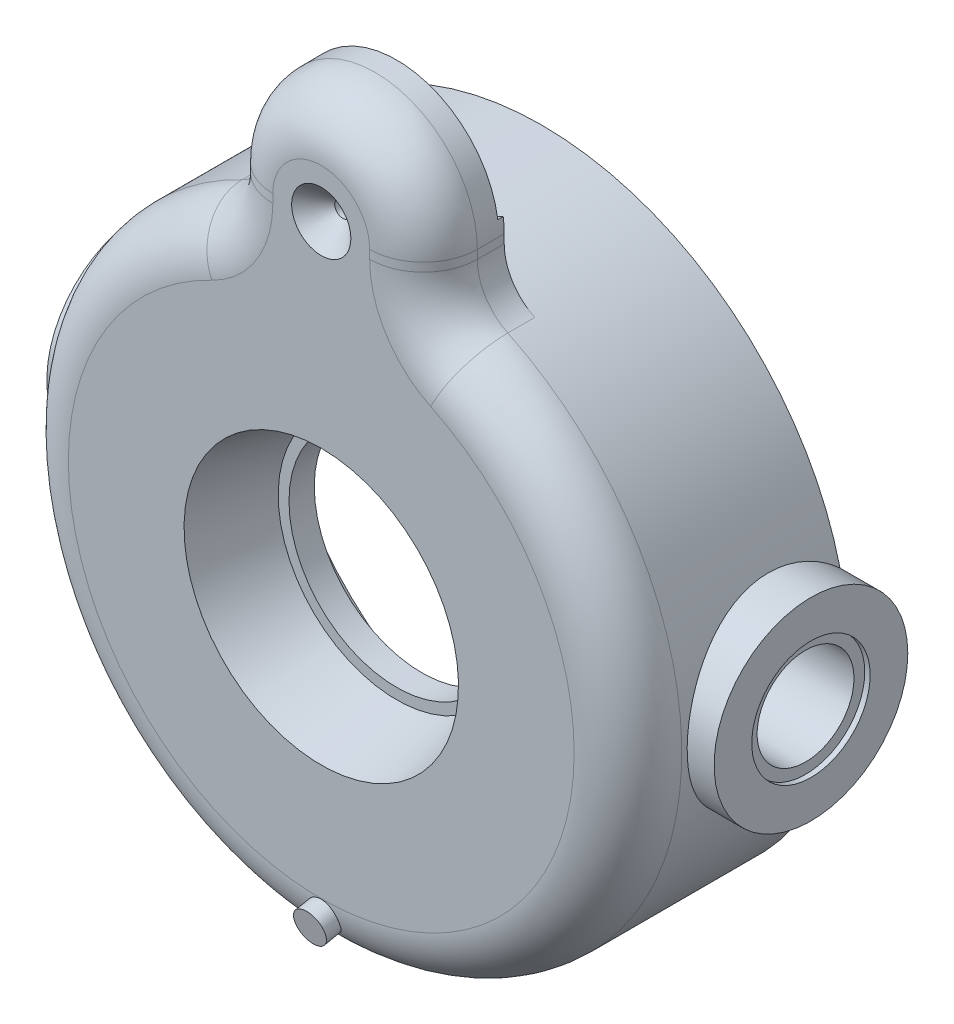
from build123d import *

# Parameters (mm, degrees)
SKETCH_1_R            = 57
EXTRUDE_1_DEPTH       = 41
EXTRUDE_START         = -15
EXTRUDE_3_DEPTH       = 15
SKETCH_5_R            = 40
CUT_EXTRUDE_1_DEPTH   = 1
SKETCH_6_R            = 51
SKETCH_7_R            = 45
SKETCH_8_R            = 20
CUT_EXTRUDE_2_DEPTH   = 102.524824572
F_3_0MM_1_D           = 3
F_3_0MM_1_DEPTH       = 7
F_3_0MM_1_CSINK_D     = 11
F_3_0MM_1_CSINK_ANGLE = 90
F_3_0MM_1_TIP         = 0.901290929
FILLET_2_R            = 10
EXTRUDE_START_2       = 62
SKETCH_14_R           = 18
EXTRUDE_4_DEPTH       = 17
SKETCH_15_R           = 11
CUT_EXTRUDE_3_DEPTH   = 1
CUT_EXTRUDE_4_REACH   = 150.883
SKETCH_16_R           = 9
SWEEP_1_PROFILE_R     = 3


with BuildPart() as part:
    # 草图1 → 凸台-拉伸1 (new body)
    with BuildSketch(Plane.XY):
        Circle(SKETCH_1_R)
    extrude(amount=EXTRUDE_1_DEPTH)

    # 草图4 → 凸台-拉伸3 (add)
    with BuildSketch(Plane.XY.offset(41).offset(EXTRUDE_START)):
        with BuildLine():
            Line((19, 62), (19, 60.398675482))
            ThreePointArc((19, 60.398675482), (20.53585261, 55.073432863), (24.671641791, 51.383947798))
            ThreePointArc((24.671641791, 51.383947798), (0, -57), (-24.671641791, 51.383947798))
            ThreePointArc((-24.671641791, 51.383947798), (-20.53585261, 55.073432863), (-19, 60.398675482))
            Line((-19, 60.398675482), (-19, 62))
            ThreePointArc((-19, 62), (0, 81), (19, 62))
        make_face()
    extrude(amount=EXTRUDE_3_DEPTH)

    # 草图5 → 切除-拉伸1 (cut)
    with BuildSketch(Plane.XY.offset(26)):
        with Locations((0, 100)):
            Circle(SKETCH_5_R)
    extrude(amount=CUT_EXTRUDE_1_DEPTH, mode=Mode.SUBTRACT)

    # 草图6 → 切除-放样1 section 0
    with BuildSketch(Plane(origin=(0, 0, 0), x_dir=(-1, 0, 0), z_dir=(0, 0, -1))):
        Circle(SKETCH_6_R)
    # 草图7 → 切除-放样1 section 1
    with BuildSketch(Plane(origin=(0, 0, 22.3), x_dir=(-1, 0, 0), z_dir=(0, 0, -1))):
        Circle(SKETCH_7_R)
    loft(mode=Mode.SUBTRACT)

    # 草图8 → 切除-拉伸2 (cut, through all)
    with BuildSketch(Plane(origin=(0, 0, 22.3), x_dir=(-1, 0, 0), z_dir=(0, 0, -1))):
        Circle(SKETCH_8_R)
    extrude(amount=-CUT_EXTRUDE_2_DEPTH, mode=Mode.SUBTRACT)

    # 草图10 → 切除-旋转1 (revolve, cut)
    with BuildSketch(Plane(origin=(0, 0, 0), x_dir=(0, 0, -1), z_dir=(1, 0, 0)), mode=Mode.PRIVATE) as cut_revolve_1_sk:
        Polygon((-41, 0), (-41, 25.5), (-27, 22), (-27, 0), align=None)
    revolve(cut_revolve_1_sk.sketch.rotate(Axis((0, 0, 0), (0, 0, 1)), 25.647663546), axis=Axis((0, 0, 0), (0, 0, 1)), mode=Mode.SUBTRACT)

    # Ø3.0mm 暗销孔1
    with Locations(Plane.XY.offset(41)):
        with Locations((0, 62)):
            CounterSinkHole(F_3_0MM_1_D / 2, F_3_0MM_1_CSINK_D / 2, depth=F_3_0MM_1_DEPTH, counter_sink_angle=F_3_0MM_1_CSINK_ANGLE)
            with Locations((0, 0, -(F_3_0MM_1_DEPTH + F_3_0MM_1_TIP / 2))):  # 118° drill point
                Cone(0, F_3_0MM_1_D / 2, F_3_0MM_1_TIP, mode=Mode.SUBTRACT)

    # 圆角2
    fillet_2_edges = [part.edges().sort_by_distance(p)[0] for p in [
        (-30.35388293, -48.245640125, 41),
        (20.53585261, 55.073432863, 41),
        (19, 61.199337741, 41),
        (0, 81, 41),
        (-19, 61.199337741, 41),
        (-20.53585261, 55.073432863, 41),
    ]]
    fillet(fillet_2_edges, radius=FILLET_2_R)

    # 草图14 → 凸台-拉伸4 (add)
    with BuildSketch(Plane(origin=(0, 0, 0), x_dir=(0, 0, -1), z_dir=(1, 0, 0)).offset(EXTRUDE_START_2)):
        with Locations((-12, 0)):
            Circle(SKETCH_14_R)
    extrude_4 = extrude(amount=-EXTRUDE_4_DEPTH)

    # 草图15 → 切除-拉伸3 (cut)
    with BuildSketch(Plane(origin=(62, 0, 0), x_dir=(0, 0, -1), z_dir=(1, 0, 0))):
        with Locations((-12, 0)):
            Circle(SKETCH_15_R)
    cut_extrude_3 = extrude(amount=-CUT_EXTRUDE_3_DEPTH, mode=Mode.SUBTRACT)

    # 草图16 → 切除-拉伸4 (cut, up to next)
    with BuildSketch(Plane(origin=(61, 0, 0), x_dir=(0, 0, -1), z_dir=(1, 0, 0)), mode=Mode.PRIVATE) as cut_extrude_4_sk1:
        with Locations((-12, 0)):
            Circle(SKETCH_16_R)
    cut_extrude_4_tool1 = extrude(cut_extrude_4_sk1.sketch, amount=-CUT_EXTRUDE_4_REACH, mode=Mode.PRIVATE) & part.part
    cut_extrude_4 = cut_extrude_4_tool1.solids().sort_by_distance((61, 0, 12))[0]
    add(cut_extrude_4, mode=Mode.SUBTRACT)

    # 镜向2: 凸台-拉伸4, 切除-拉伸3, 切除-拉伸4 across plane
    add(extrude_4.mirror(Plane(origin=(0, 0, 0), x_dir=(0, 0, 1), z_dir=(1, 0, 0))))
    add(cut_extrude_3.mirror(Plane(origin=(0, 0, 0), x_dir=(0, 0, 1), z_dir=(1, 0, 0))), mode=Mode.SUBTRACT)
    add(cut_extrude_4.mirror(Plane(origin=(0, 0, 0), x_dir=(0, 0, 1), z_dir=(1, 0, 0))), mode=Mode.SUBTRACT)

    # 扫描1: sweep along a path in 草图17
    with BuildLine(Plane(origin=(0, 0, 0), x_dir=(0, 0, -1), z_dir=(1, 0, 0))) as sweep_1_path:
        Line((-43.1, -50.6), (-35.054731359, -48.88992536))
    # 扫描1 profile (on start of the path) → 扫描1 (sweep)
    with BuildSketch(Plane(origin=(0, -50.6, 43.1), x_dir=(0, -0.9781476007338048, -0.20791169081776342), z_dir=(0, 0.20791169081776342, -0.9781476007338048))):
        Circle(SWEEP_1_PROFILE_R)
    sweep(path=sweep_1_path.line)


solid = part.part
